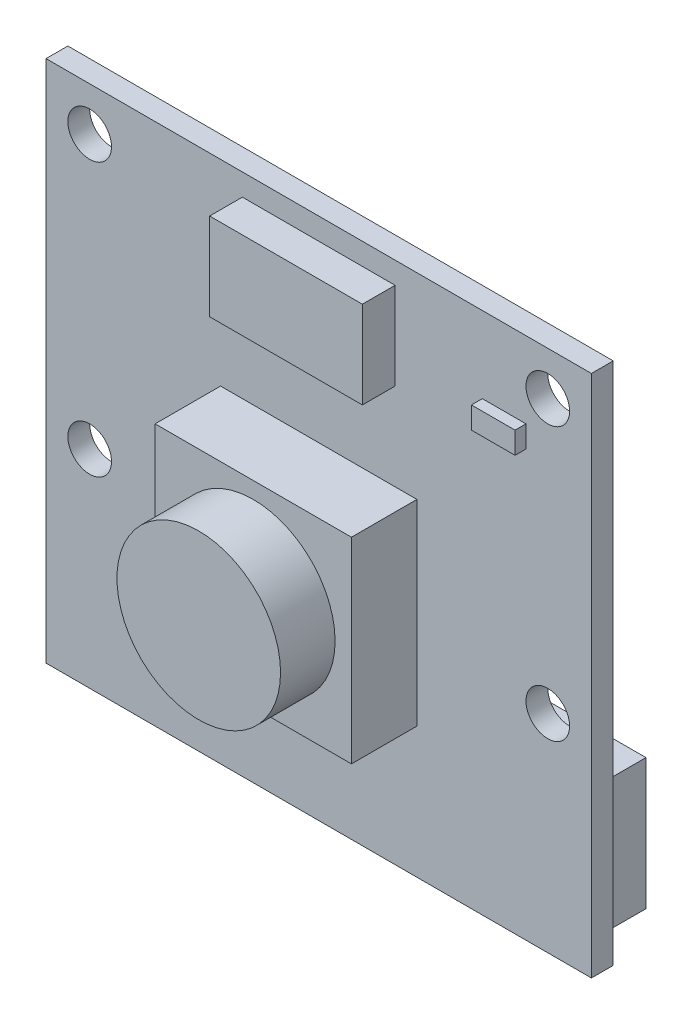
from build123d import *

# Parameters (mm, degrees)
CROQUIS1_W              = 25
CROQUIS1_H              = 24
CROQUIS1_R              = 1
SALIENTE_EXTRUIR1_DEPTH = 1
CROQUIS1_3_W            = 2
CROQUIS1_3_H            = 1
SALIENTE_EXTRUIR2_DEPTH = 1.5
CROQUIS1_4_W            = 7
CROQUIS1_4_H            = 4
SALIENTE_EXTRUIR3_DEPTH = 2.5
CROQUIS1_5_W            = 9
CROQUIS1_5_H            = 9
SALIENTE_EXTRUIR4_DEPTH = 4
CROQUIS3_R              = 3.75
SALIENTE_EXTRUIR5_DEPTH = 2.5
CROQUIS4_W              = 22
CROQUIS4_H              = 6
SALIENTE_EXTRUIR6_DEPTH = 3
SCALE1_SCALE            = 1.3


with BuildPart() as part:
    # Croquis1 → Saliente-Extruir1 (new body)
    with BuildSketch(Plane.XY):
        with Locations((0, 1.5)):
            Rectangle(CROQUIS1_W, CROQUIS1_H)
        with Locations((-10.5, -1)):
            Circle(CROQUIS1_R, mode=Mode.SUBTRACT)
        with Locations((10.5, -1)):
            Circle(CROQUIS1_R, mode=Mode.SUBTRACT)
        with Locations((-10.5, 11.5)):
            Circle(CROQUIS1_R, mode=Mode.SUBTRACT)
        with Locations((10.5, 11.5)):
            Circle(CROQUIS1_R, mode=Mode.SUBTRACT)
    extrude(amount=SALIENTE_EXTRUIR1_DEPTH)

    # Croquis1<3> → Saliente-Extruir2 (add)
    with BuildSketch(Plane.XY):
        with Locations((8.5, 9.5)):
            Rectangle(CROQUIS1_3_W, CROQUIS1_3_H)
    extrude(amount=SALIENTE_EXTRUIR2_DEPTH)

    # Croquis1<4> → Saliente-Extruir3 (add)
    with BuildSketch(Plane.XY):
        with Locations((0, 10.5)):
            Rectangle(CROQUIS1_4_W, CROQUIS1_4_H)
    extrude(amount=SALIENTE_EXTRUIR3_DEPTH)

    # Croquis1<5> → Saliente-Extruir4 (add)
    with BuildSketch(Plane.XY):
        Rectangle(CROQUIS1_5_W, CROQUIS1_5_H)
    extrude(amount=SALIENTE_EXTRUIR4_DEPTH)

    # Croquis3 → Saliente-Extruir5 (add)
    with BuildSketch(Plane.XY.offset(4)):
        Circle(CROQUIS3_R)
    extrude(amount=SALIENTE_EXTRUIR5_DEPTH)

    # Croquis4 → Saliente-Extruir6 (add)
    with BuildSketch(Plane(origin=(0, 0, 0), x_dir=(-1, 0, 0), z_dir=(0, 0, -1))):
        with Locations((0, -7.5)):
            Rectangle(CROQUIS4_W, CROQUIS4_H)
    extrude(amount=SALIENTE_EXTRUIR6_DEPTH)


with BuildPart() as part_1:
    # Scale1: scaled about (0, 0, 0)
    add(part.part.scale(SCALE1_SCALE))


solid = part_1.part
